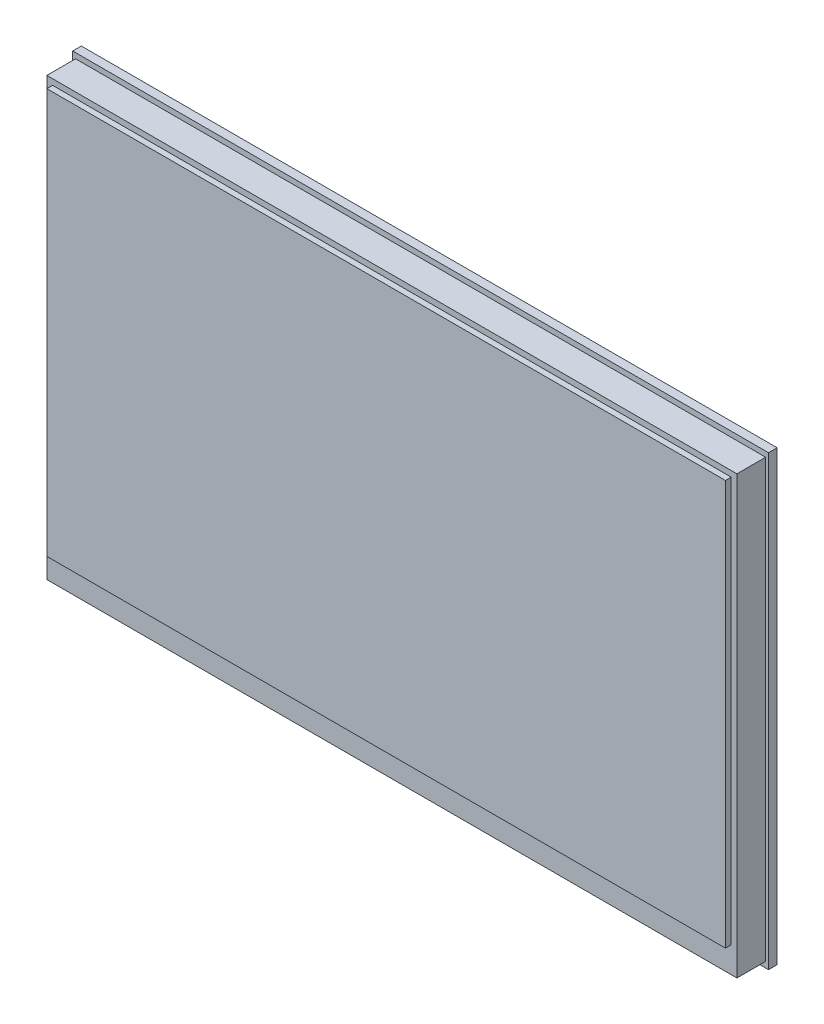
from build123d import *

# Parameters (mm, degrees)
SKETCH_1_W            = 121.11
SKETCH_1_H            = 77.93
EXTRUDE_1_DEPTH       = 1.5
HOLE_WIZARD_2_0_2_1_D = 2
SKETCH_4_W            = 120.11
SKETCH_4_H            = 76
EXTRUDE_2_DEPTH       = 5
SKETCH_5_W            = 118.11
SKETCH_5_H            = 70.5
EXTRUDE_3_DEPTH       = 1


with BuildPart() as part:
    # 草图1 → 凸台-拉伸1 (new body)
    with BuildSketch(Plane.XY):
        with Locations((60.555, 38.965)):
            Rectangle(SKETCH_1_W, SKETCH_1_H)
    extrude(amount=EXTRUDE_1_DEPTH)

    # Ø2.0 (2) 直径孔1 (through all)
    with Locations(Plane.XY.offset(1.5)):
        with Locations((23.02, 74.29), (23.02, 5), (116.11, 74.29), (116.11, 5)):
            Hole(HOLE_WIZARD_2_0_2_1_D / 2)

    # 草图4 → 凸台-拉伸2 (add)
    with BuildSketch(Plane.XY.offset(1.5)):
        with Locations((60.555, 39)):
            Rectangle(SKETCH_4_W, SKETCH_4_H)
    extrude(amount=EXTRUDE_2_DEPTH)

    # 草图5 → 凸台-拉伸3 (add)
    with BuildSketch(Plane.XY.offset(6.5)):
        with Locations((60.555, 40.75)):
            Rectangle(SKETCH_5_W, SKETCH_5_H)
    extrude(amount=EXTRUDE_3_DEPTH)


solid = part.part
